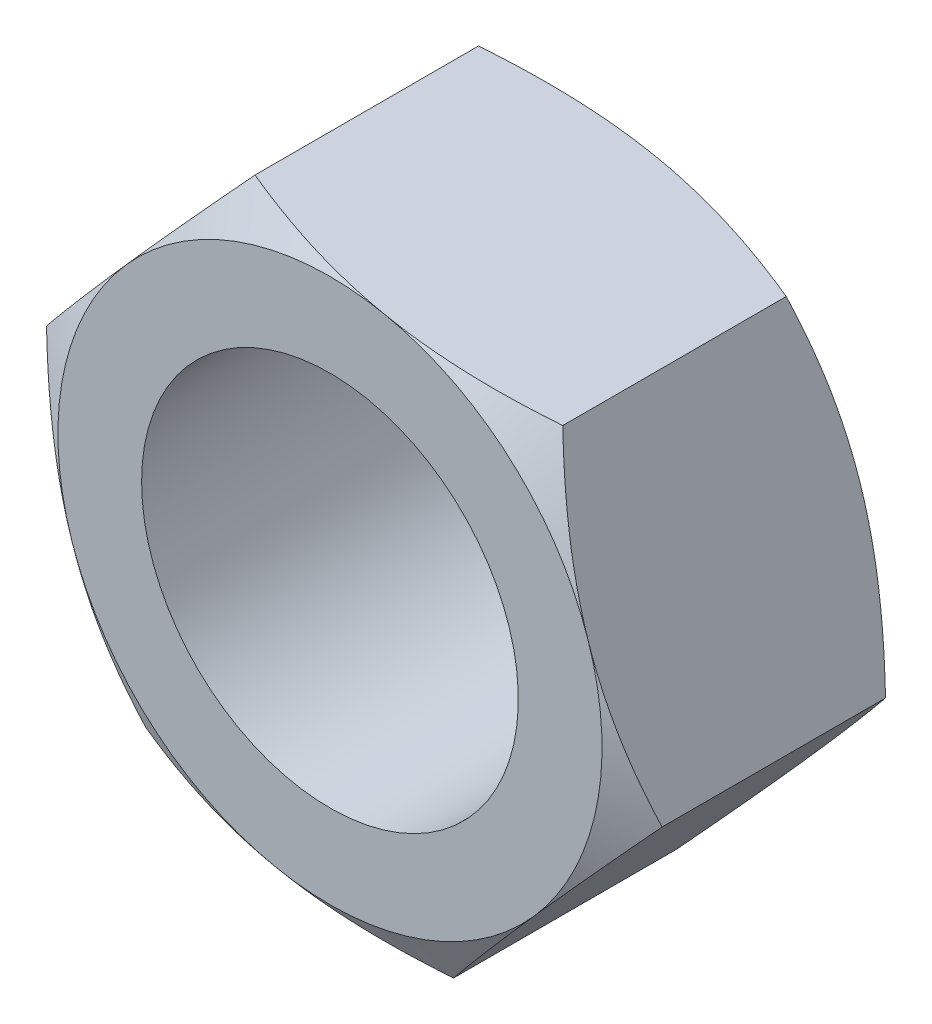
from build123d import *

# Parameters (mm, degrees)
BOSS_EXTRUDE1_DEPTH = 6.5
SKETCH2_OUTSIDE_W   = 43.518
SKETCH2_OUTSIDE_H   = 43.054
SKETCH2_OUTSIDE_R   = 6.5
CUT_EXTRUDE1_DEPTH  = 6.5
CUT_EXTRUDE1_DRAFT  = -60
SKETCH3_OUTSIDE_W   = 43.518
SKETCH3_OUTSIDE_H   = 43.054
SKETCH3_OUTSIDE_R   = 6.5
CUT_EXTRUDE2_DEPTH  = 6.5
CUT_EXTRUDE2_DRAFT  = -60
SKETCH4_R           = 4.5
CUT_EXTRUDE3_DEPTH  = 13.125271319


with BuildPart() as part:
    # Sketch1 → Boss-Extrude1 (new body)
    with BuildSketch(Plane.XY):
        Polygon((4.981175881, 5.614376205), (-2.371604479, 7.121012956), (-7.352780361, 1.506636751), (-4.981175881, -5.614376205), (2.371604479, -7.121012956), (7.352780361, -1.506636751), align=None)
    extrude(amount=BOSS_EXTRUDE1_DEPTH)


with BuildPart() as cut_extrude1_tool:
    # Sketch2 outside → Cut-Extrude1 (with draft: the straight prism first)
    with BuildSketch(Plane.XY.offset(6.5)):
        Rectangle(SKETCH2_OUTSIDE_W, SKETCH2_OUTSIDE_H)
        Circle(SKETCH2_OUTSIDE_R, mode=Mode.SUBTRACT)
    extrude(amount=-CUT_EXTRUDE1_DEPTH)
    # Cut-Extrude1: the draft: its side faces are tilted about the plane it starts from
    cut_extrude1_sides = [cut_extrude1_tool.faces().sort_by_distance(p)[0] for p in [
        (0, -21.527, 3.25),
        (21.759, 0, 3.25),
        (0, 21.527, 3.25),
        (-21.759, 0, 3.25),
        (-6.5, 0, 3.25),
    ]]
    draft(cut_extrude1_sides, Plane.XY.offset(6.5), CUT_EXTRUDE1_DRAFT)


with BuildPart() as part_1:
    add(part.part)

    # Cut-Extrude1: cut by cut_extrude1_tool
    add(cut_extrude1_tool.part, mode=Mode.SUBTRACT)


with BuildPart() as cut_extrude2_tool:
    # Sketch3 outside → Cut-Extrude2 (with draft: the straight prism first)
    with BuildSketch(Plane(origin=(0, 0, 0), x_dir=(-1, 0, 0), z_dir=(0, 0, -1))):
        Rectangle(SKETCH3_OUTSIDE_W, SKETCH3_OUTSIDE_H)
        Circle(SKETCH3_OUTSIDE_R, mode=Mode.SUBTRACT)
    extrude(amount=-CUT_EXTRUDE2_DEPTH)
    # Cut-Extrude2: the draft: its side faces are tilted about the plane it starts from
    cut_extrude2_sides = [cut_extrude2_tool.faces().sort_by_distance(p)[0] for p in [
        (0, -21.527, 3.25),
        (-21.759, 0, 3.25),
        (0, 21.527, 3.25),
        (21.759, 0, 3.25),
        (6.5, 0, 3.25),
    ]]
    draft(cut_extrude2_sides, Plane(origin=(0, 0, 0), x_dir=(-1, 0, 0), z_dir=(0, 0, -1)), CUT_EXTRUDE2_DRAFT)


with BuildPart() as part_2:
    add(part_1.part)

    # Cut-Extrude2: cut by cut_extrude2_tool
    add(cut_extrude2_tool.part, mode=Mode.SUBTRACT)

    # Sketch4 → Cut-Extrude3 (cut, through all)
    with BuildSketch(Plane(origin=(0, 0, 0), x_dir=(-1, 0, 0), z_dir=(0, 0, -1))):
        Circle(SKETCH4_R)
    extrude(amount=-CUT_EXTRUDE3_DEPTH, mode=Mode.SUBTRACT)


solid = part_2.part
